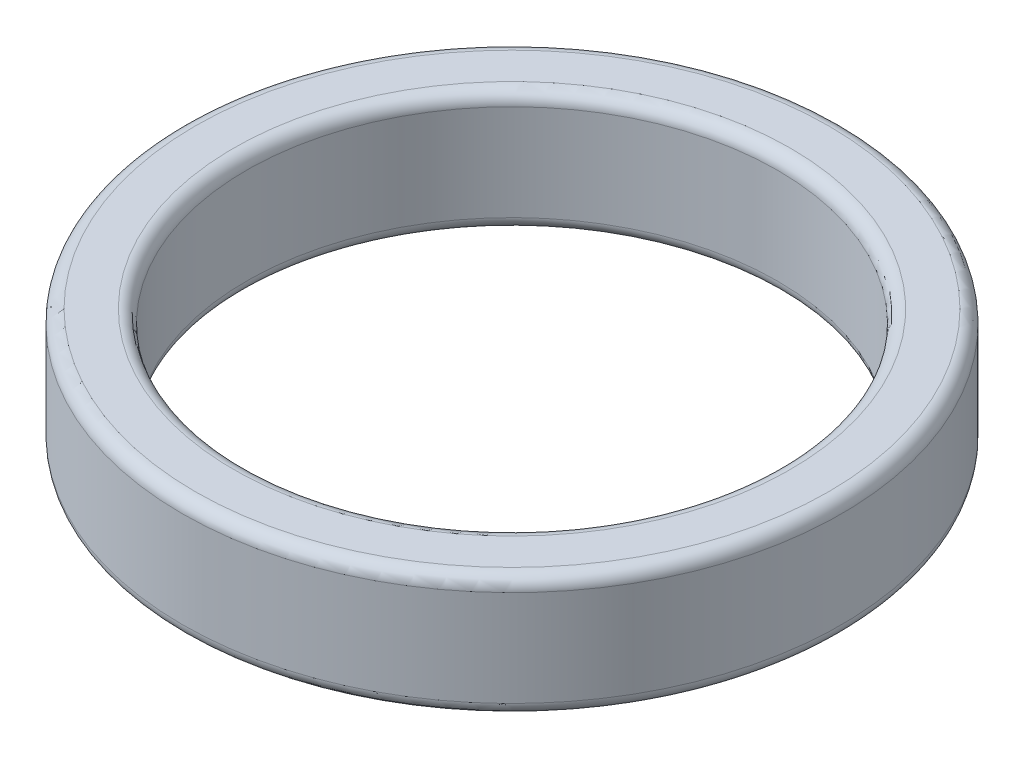
from build123d import *


with BuildPart() as part:
    # Эскиз1 → Повернуть1 (revolve)
    with BuildSketch(Plane.XY, mode=Mode.PRIVATE) as revolve_1_sk:
        with BuildLine():
            Line((-4.35, 0.3), (-4.95, 0.3))
            ThreePointArc((-4.95, 0.3), (-5.091421356, 0.358578644), (-5.15, 0.5))
            Line((-5.15, 0.5), (-5.15, 2))
            ThreePointArc((-5.15, 2), (-5.091421356, 2.141421356), (-4.95, 2.2))
            Line((-4.95, 2.2), (-4.35, 2.2))
            ThreePointArc((-4.35, 2.2), (-4.208578644, 2.141421356), (-4.15, 2))
            Line((-4.15, 2), (-4.15, 0.5))
            ThreePointArc((-4.15, 0.5), (-4.208578644, 0.358578644), (-4.35, 0.3))
        make_face()
    revolve(revolve_1_sk.sketch.rotate(Axis((0, 0, 0), (0, 1, 0)), 270), axis=Axis((0, 0, 0), (0, 1, 0)))


solid = part.part
